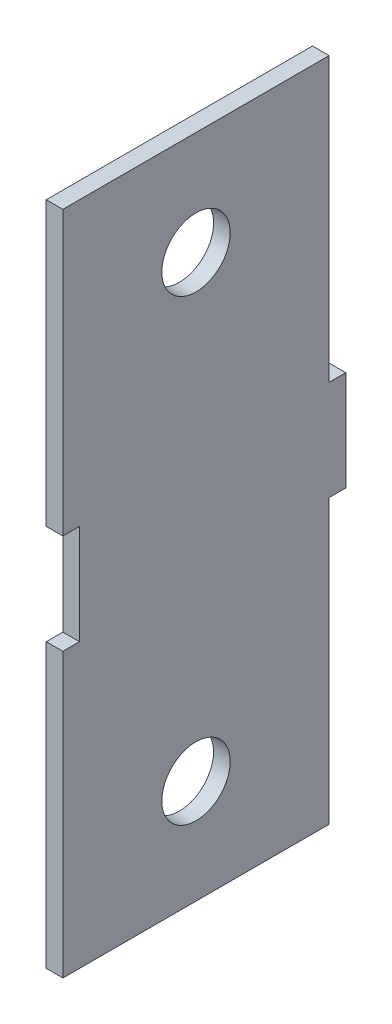
from build123d import *

# Parameters (mm, degrees)
SKETCH2_W           = 25.4
SKETCH2_H           = 63.5
SKETCH2_R           = 3.2639
BOSS_EXTRUDE1_DEPTH = 1.5875
SKETCH3_W           = 1.5875
SKETCH3_H           = 9.525
BOSS_EXTRUDE2_DEPTH = 1.5875
SKETCH3_4_W         = 1.5875
SKETCH3_4_H         = 9.525
CUT_EXTRUDE1_DEPTH  = 3.175


with BuildPart() as part:
    # Sketch2 → Boss-Extrude1 (new body)
    with BuildSketch(Plane(origin=(0, 0, 0), x_dir=(0, 0, -1), z_dir=(1, 0, 0))):
        Rectangle(SKETCH2_W, SKETCH2_H)
        with Locations((0, 21.844)):
            Circle(SKETCH2_R, mode=Mode.SUBTRACT)
        with Locations((0, -21.844)):
            Circle(SKETCH2_R, mode=Mode.SUBTRACT)
    extrude(amount=BOSS_EXTRUDE1_DEPTH)

    # Sketch3 → Boss-Extrude2 (add)
    with BuildSketch(Plane(origin=(1.5875, 0, 0), x_dir=(0, 0, -1), z_dir=(1, 0, 0))):
        with Locations((13.49375, 0)):
            Rectangle(SKETCH3_W, SKETCH3_H)
    extrude(amount=-BOSS_EXTRUDE2_DEPTH)

    # Sketch3<4> → Cut-Extrude1 (cut)
    with BuildSketch(Plane(origin=(1.5875, 0, 0), x_dir=(0, 0, -1), z_dir=(1, 0, 0))):
        with Locations((-11.90625, 0)):
            Rectangle(SKETCH3_4_W, SKETCH3_4_H)
    extrude(amount=-CUT_EXTRUDE1_DEPTH, mode=Mode.SUBTRACT)


solid = part.part
